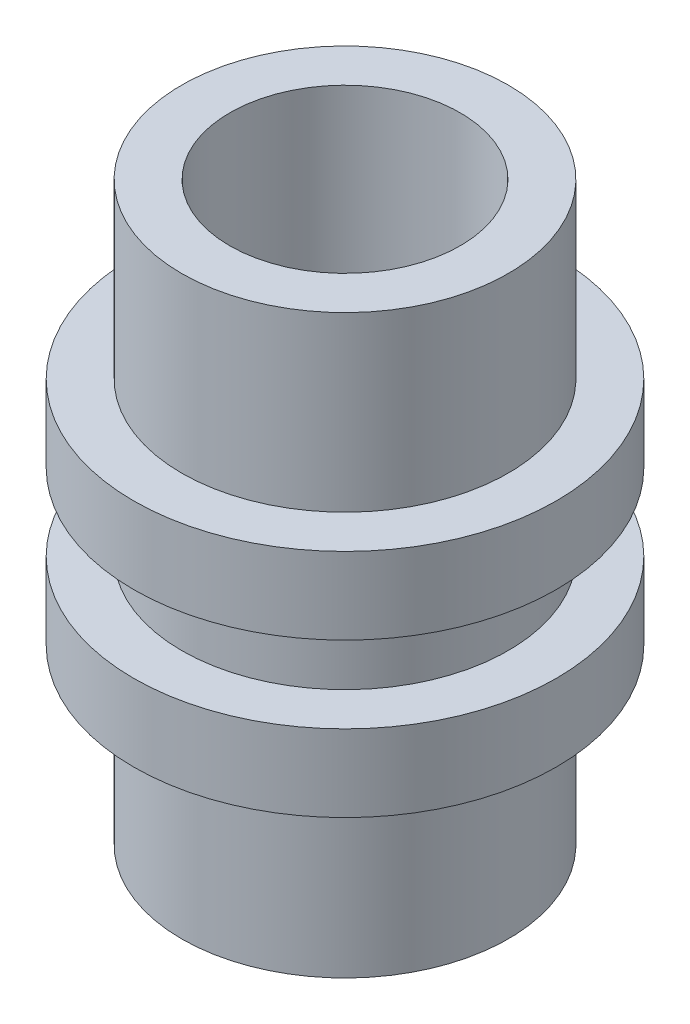
from build123d import *

# Parameters (mm, degrees)
SKETCH_1_R           = 5.5
EXTRUDE_1_DEPTH      = 6
EXTRUDE_2_DEPTH      = 4.5
EXTRUDE_2_DEPTH_BACK = 10.5
SKETCH_2_R           = 4.25
SKETCH_2_R_2         = 3
CUT_EXTRUDE_START    = -2
SKETCH_3_R           = 5.5
SKETCH_3_R_2         = 4.25
CUT_EXTRUDE_1_DEPTH  = 2


with BuildPart() as part:
    # 草图1 → 拉伸1 (new body)
    with BuildSketch(Plane(origin=(0, 0, 0), x_dir=(1, 0, 0), z_dir=(0, 1, 0))):
        with Locations(Location((0, 0, 0), (0, 0, 270))):
            Circle(SKETCH_1_R)
    extrude(amount=EXTRUDE_1_DEPTH)

    # 草图2 → 拉伸2 (add, two sides: drawn at the far end of the back side and taken through both)
    with BuildSketch(Plane(origin=(0, 6, 0), x_dir=(-1, 0, 0), z_dir=(0, 1, 0)).offset(-EXTRUDE_2_DEPTH_BACK)):
        with Locations(Location((0, 0, 0), (0, 0, 90))):
            Circle(SKETCH_2_R)
        with Locations(Location((0, 0, 0), (0, 0, 90))):
            Circle(SKETCH_2_R_2, mode=Mode.SUBTRACT)
    extrude(amount=EXTRUDE_2_DEPTH + EXTRUDE_2_DEPTH_BACK)

    # 草图3 → 切除-拉伸1 (cut)
    with BuildSketch(Plane(origin=(0, 4, 0), x_dir=(-1, 0, 0), z_dir=(0, 1, 0)).offset(CUT_EXTRUDE_START)):
        with Locations(Location((0, 0, 0), (0, 0, 90))):
            Circle(SKETCH_3_R)
        with Locations(Location((0, 0, 0), (0, 0, 90))):
            Circle(SKETCH_3_R_2, mode=Mode.SUBTRACT)
    extrude(amount=CUT_EXTRUDE_1_DEPTH, mode=Mode.SUBTRACT)


solid = part.part
